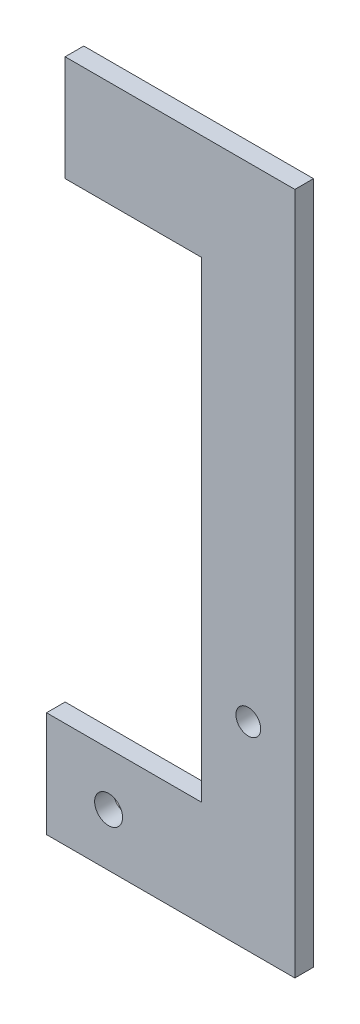
from build123d import *

# Parameters (mm, degrees)
CROQUIS1_R              = 2.25
CROQUIS1_R_2            = 2
SALIENTE_EXTRUIR1_DEPTH = 3


with BuildPart() as part:
    # Croquis1 → Saliente-Extruir1 (new body)
    with BuildSketch(Plane.XY):
        Polygon((0, 0), (40, 0), (40, 110), (23, 110), (3, 110), (3, 93), (25, 93), (25, 17), (0, 17), align=None)
        with Locations((10, 8.5)):
            Circle(CROQUIS1_R, mode=Mode.SUBTRACT)
        with Locations((32.5, 32)):
            Circle(CROQUIS1_R_2, mode=Mode.SUBTRACT)
    extrude(amount=SALIENTE_EXTRUIR1_DEPTH)


solid = part.part
